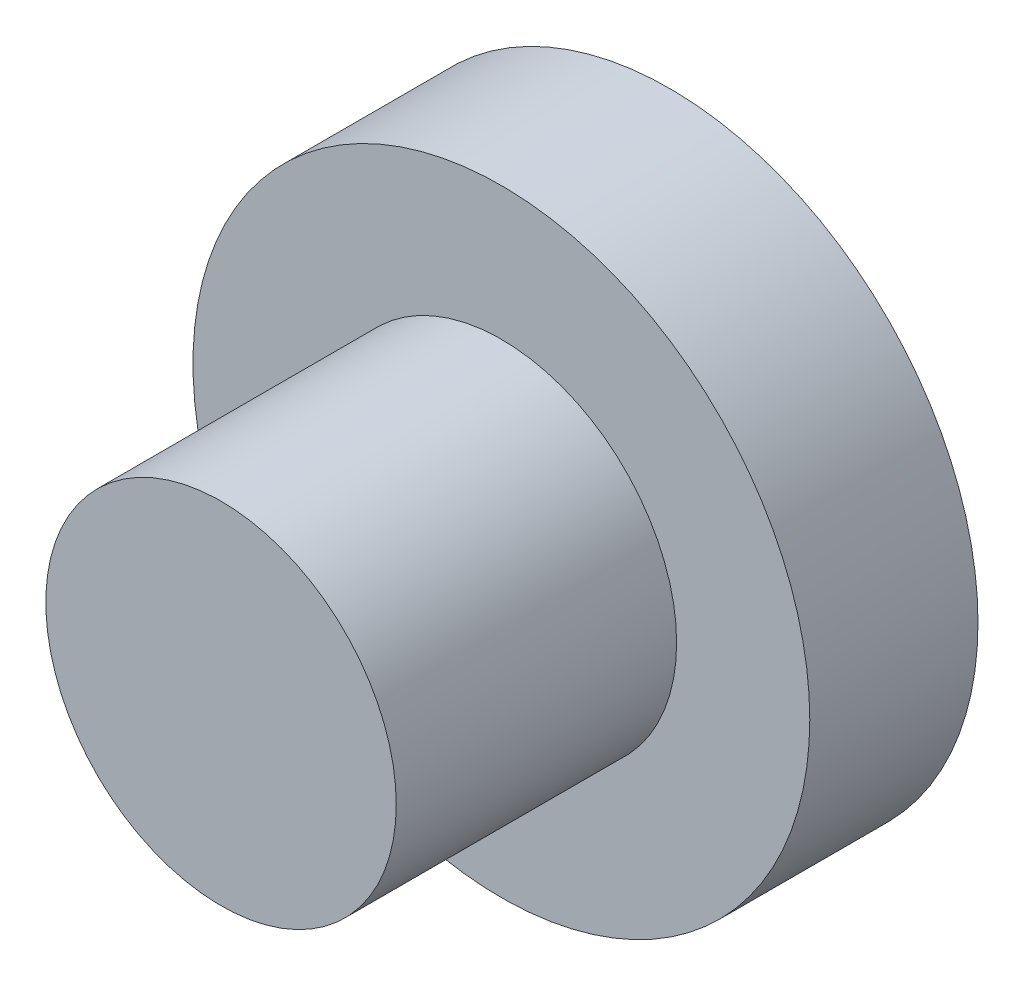
from build123d import *

# Parameters (mm, degrees)
SKETCH1_R           = 22
BOSS_EXTRUDE1_DEPTH = 12
SKETCH2_R           = 12.5
BOSS_EXTRUDE2_DEPTH = 20


with BuildPart() as part:
    # Sketch1 → Boss-Extrude1 (new body)
    with BuildSketch(Plane.XY):
        Circle(SKETCH1_R)
    extrude(amount=BOSS_EXTRUDE1_DEPTH)

    # Sketch2 → Boss-Extrude2 (add)
    with BuildSketch(Plane.XY.offset(12)):
        Circle(SKETCH2_R)
    extrude(amount=BOSS_EXTRUDE2_DEPTH)


solid = part.part
